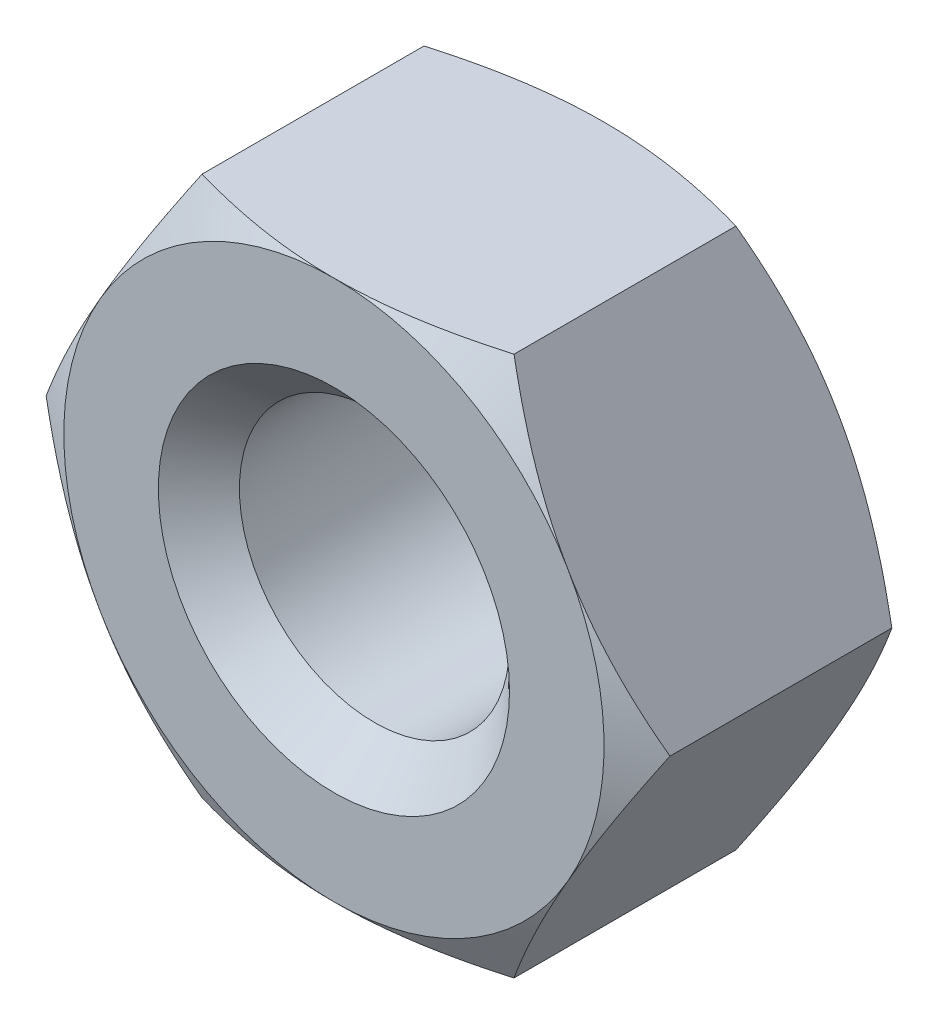
from build123d import *

# Parameters (mm, degrees)
SKETCH_1_R          = 2
EXTRUDE_1_DEPTH     = 4
SKETCH_2_OUTSIDE_W  = 27.666
SKETCH_2_OUTSIDE_H  = 26.428
SKETCH_2_OUTSIDE_R  = 4
CUT_EXTRUDE_2_DEPTH = 4
CUT_EXTRUDE_2_DRAFT = -60
SKETCH_3_OUTSIDE_W  = 27.666
SKETCH_3_OUTSIDE_H  = 26.428
SKETCH_3_OUTSIDE_R  = 4
CUT_EXTRUDE_3_DEPTH = 4
CUT_EXTRUDE_3_DRAFT = -60
CHAMFER_5_SIZE      = 0.6


with BuildPart() as part:
    # Эскиз1 → Бобышка-Вытянуть1 (new body)
    with BuildSketch(Plane.XY):
        Polygon((4.618802154, 0), (2.309401077, 4), (-2.309401077, 4), (-4.618802154, 0), (-2.309401077, -4), (2.309401077, -4), align=None)
        Circle(SKETCH_1_R, mode=Mode.SUBTRACT)
    extrude(amount=EXTRUDE_1_DEPTH)


with BuildPart() as cut_extrude_2_tool:
    # Эскиз2 outside → Вырез-Вытянуть2 (with draft: the straight prism first)
    with BuildSketch(Plane(origin=(0, 0, 0), x_dir=(-1, 0, 0), z_dir=(0, 0, -1))):
        Rectangle(SKETCH_2_OUTSIDE_W, SKETCH_2_OUTSIDE_H)
        Circle(SKETCH_2_OUTSIDE_R, mode=Mode.SUBTRACT)
    extrude(amount=-CUT_EXTRUDE_2_DEPTH)
    # Вырез-Вытянуть2: the draft: its side faces are tilted about the plane it starts from
    cut_extrude_2_sides = [cut_extrude_2_tool.faces().sort_by_distance(p)[0] for p in [
        (0, -13.214, 2),
        (-13.833, 0, 2),
        (0, 13.214, 2),
        (13.833, 0, 2),
        (4, 0, 2),
    ]]
    draft(cut_extrude_2_sides, Plane(origin=(0, 0, 0), x_dir=(-1, 0, 0), z_dir=(0, 0, -1)), CUT_EXTRUDE_2_DRAFT)


with BuildPart() as part_1:
    add(part.part)

    # Вырез-Вытянуть2: cut by cut_extrude_2_tool
    add(cut_extrude_2_tool.part, mode=Mode.SUBTRACT)


with BuildPart() as cut_extrude_3_tool:
    # Эскиз3 outside → Вырез-Вытянуть3 (with draft: the straight prism first)
    with BuildSketch(Plane.XY.offset(4)):
        Rectangle(SKETCH_3_OUTSIDE_W, SKETCH_3_OUTSIDE_H)
        Circle(SKETCH_3_OUTSIDE_R, mode=Mode.SUBTRACT)
    extrude(amount=-CUT_EXTRUDE_3_DEPTH)
    # Вырез-Вытянуть3: the draft: its side faces are tilted about the plane it starts from
    cut_extrude_3_sides = [cut_extrude_3_tool.faces().sort_by_distance(p)[0] for p in [
        (0, -13.214, 2),
        (13.833, 0, 2),
        (0, 13.214, 2),
        (-13.833, 0, 2),
        (-4, 0, 2),
    ]]
    draft(cut_extrude_3_sides, Plane.XY.offset(4), CUT_EXTRUDE_3_DRAFT)


with BuildPart() as part_2:
    add(part_1.part)

    # Вырез-Вытянуть3: cut by cut_extrude_3_tool
    add(cut_extrude_3_tool.part, mode=Mode.SUBTRACT)

    # Фаска5
    chamfer_5_edges = [part_2.edges().sort_by_distance(p)[0] for p in [
        (-2, 0, 0),
        (-2, 0, 4),
    ]]
    chamfer(chamfer_5_edges, length=CHAMFER_5_SIZE)


solid = part_2.part
